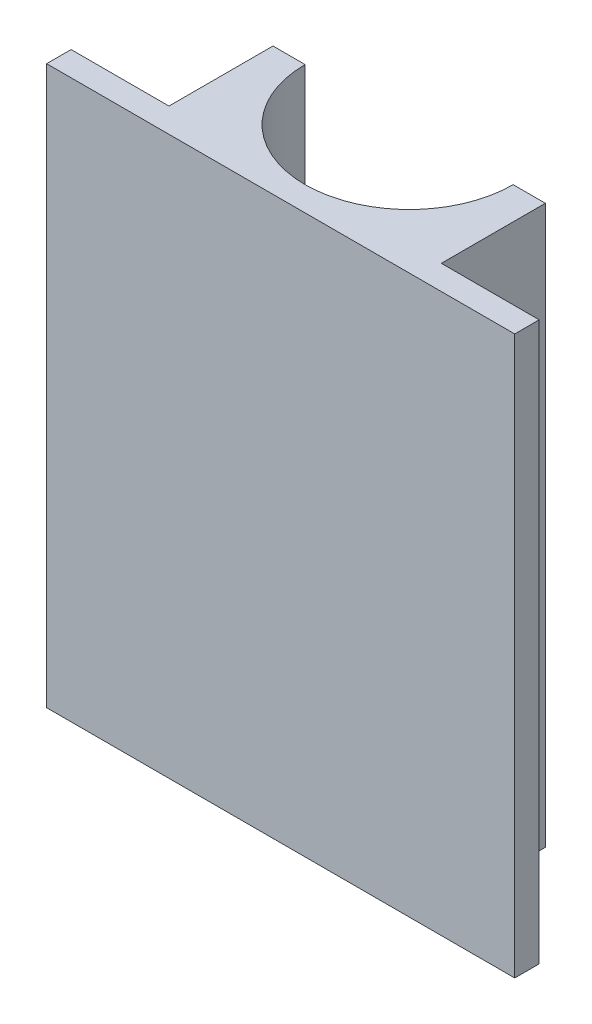
from build123d import *

# Parameters (mm, degrees)
BOSS_EXTRUDE3_DEPTH = 72.39
BOSS_EXTRUDE4_DEPTH = 51.39


with BuildPart() as part:
    # Sketch1 → Boss-Extrude3 (new body)
    with BuildSketch(Plane(origin=(0, 0, 0), x_dir=(1, 0, 0), z_dir=(0, 1, 0))):
        with BuildLine():
            Line((-11.1466884, 17.698170271), (-23.8485284, 17.698170271))
            Line((-23.8485284, 17.698170271), (-23.8485284, 14.523170271))
            Line((-23.8485284, 14.523170271), (36.9033116, 14.523170271))
            Line((36.9033116, 14.523170271), (36.9033116, 17.698170271))
            Line((36.9033116, 17.698170271), (24.2033116, 17.698170271))
            Line((24.2033116, 17.698170271), (24.2033116, 31.198170271))
            Line((24.2033116, 31.198170271), (20.025, 31.198170271))
            ThreePointArc((20.025, 31.198170271), (6.525, 17.69817027), (-6.975, 31.198170271))
            Line((-6.975, 31.198170271), (-11.1466884, 31.198170271))
            Line((-11.1466884, 31.198170271), (-11.1466884, 17.698170271))
        make_face()
    extrude(amount=BOSS_EXTRUDE3_DEPTH)

    # Sketch1<13> → Boss-Extrude4 (add)
    with BuildSketch(Plane(origin=(0, 0, 0), x_dir=(1, 0, 0), z_dir=(0, 1, 0))):
        with BuildLine():
            Line((-6.975, 31.198170271), (-6.675, 31.198170271))
            ThreePointArc((-6.675, 31.198170271), (6.525, 17.99817027), (19.725, 31.198170271))
            Line((19.725, 31.198170271), (20.025, 31.198170271))
            ThreePointArc((20.025, 31.198170271), (6.525, 17.69817027), (-6.975, 31.198170271))
        make_face()
    extrude(amount=BOSS_EXTRUDE4_DEPTH)


solid = part.part
